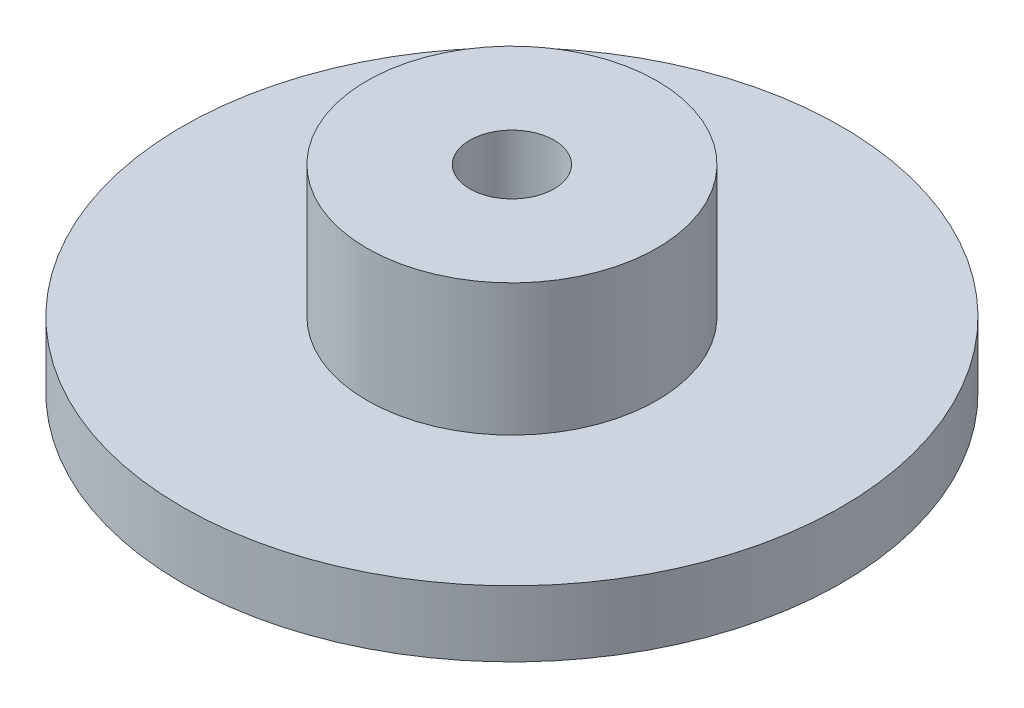
from build123d import *

# Parameters (mm, degrees)
SKETCH1_R           = 12.5
BOSS_EXTRUDE1_DEPTH = 2.5
SKETCH2_R           = 5.5
BOSS_EXTRUDE2_DEPTH = 5
HOLE1_D             = 3.2
HOLE1_DEPTH         = 100
HOLE1_CBORE_D       = 8
HOLE1_CBORE_DEPTH   = 3


with BuildPart() as part:
    # Sketch1 → Boss-Extrude1 (new body)
    with BuildSketch(Plane(origin=(0, 0, 0), x_dir=(1, 0, 0), z_dir=(0, 1, 0))):
        with Locations(Location((0, 0, 0), (0, 0, 270))):
            Circle(SKETCH1_R)
    extrude(amount=BOSS_EXTRUDE1_DEPTH)

    # Sketch2 → Boss-Extrude2 (add)
    with BuildSketch(Plane(origin=(0, 2.5, 0), x_dir=(1, 0, 0), z_dir=(0, 1, 0))):
        with Locations(Location((0, 0, 0), (0, 0, 270))):
            Circle(SKETCH2_R)
    extrude(amount=BOSS_EXTRUDE2_DEPTH)

    # Hole1
    with Locations(Plane(origin=(0, 0, 0), x_dir=(-1, 0, 0), z_dir=(0, -1, 0))):
        with Locations((0, 0)):
            CounterBoreHole(HOLE1_D / 2, HOLE1_CBORE_D / 2, HOLE1_CBORE_DEPTH, depth=HOLE1_DEPTH)


solid = part.part
